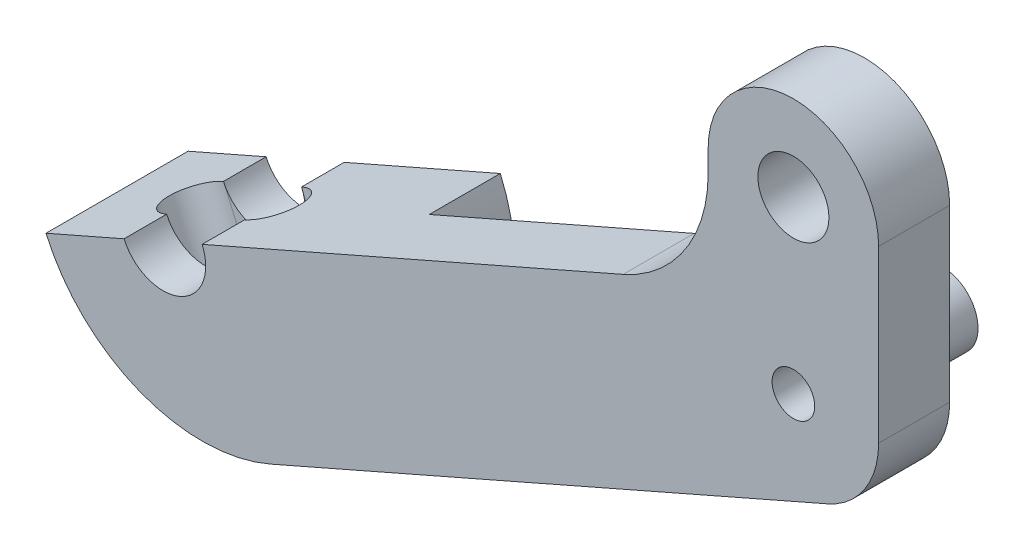
from build123d import *

# Parameters (mm, degrees)
ESBO_O7_R                = 2.5
RESSALTO_EXTRUS_O1_DEPTH = 5
ESBO_O8_R                = 2.5
RESSALTO_EXTRUS_O2_DEPTH = 5.5
ESBO_O9_R                = 1.5
CORTE_EXTRUS_O4_DEPTH    = 25
RESSALTO_EXTRUS_O3_START = 5
RESSALTO_EXTRUS_O3_DEPTH = 5
CORTE_EXTRUS_O5_DEPTH    = 16
SKETCH1_R                = 3.5
SKETCH1_R_2              = 2.5
BOSS_EXTRUDE1_DEPTH      = 0.5


with BuildPart() as part:
    # Esboço7 → Ressalto-extrusão1 (new body)
    with BuildSketch(Plane.XY):
        with BuildLine():
            Line((6, 0), (6, -12))
            ThreePointArc((6, -12), (5.022409129, -15.282591437), (2.40819782, -17.495505733))
            Line((2.40819782, -17.495505733), (-36.810520187, -34.681627592))
            ThreePointArc((-36.810520187, -34.681627592), (-45.993028549, -34.868140884), (-52.617927293, -28.507011766))
            Line((-52.617927293, -28.507011766), (-47.12242156, -26.098813946))
            ThreePointArc((-47.12242156, -26.098813946), (-43.170569784, -27.642467903), (-41.626915827, -23.690616126))
            Line((-41.626915827, -23.690616126), (-11.986336967, -10.701751978))
            ThreePointArc((-11.986336967, -10.701751978), (-7.629318118, -7.013561484), (-6, -1.542575756))
            Line((-6, -1.542575756), (-6, 0))
            ThreePointArc((-6, 0), (0, 6), (6, 0))
        make_face()
        Circle(ESBO_O7_R, mode=Mode.SUBTRACT)
    extrude(amount=RESSALTO_EXTRUS_O1_DEPTH)

    # Esboço8 → Ressalto-extrusão2 (add)
    with BuildSketch(Plane(origin=(0, 0, 0), x_dir=(-1, 0, 0), z_dir=(0, 0, -1))):
        with Locations(Location((0, -12, 0), (0, 0, 180))):
            Circle(ESBO_O8_R)
    extrude(amount=RESSALTO_EXTRUS_O2_DEPTH)

    # Esboço9 → Corte-extrusão4 (cut)
    with BuildSketch(Plane(origin=(0, 0, -5.5), x_dir=(-1, 0, 0), z_dir=(0, 0, -1))):
        with Locations((0, -12)):
            Circle(ESBO_O9_R)
    extrude(amount=-CORTE_EXTRUS_O4_DEPTH, mode=Mode.SUBTRACT)

    # Esboço10 → Ressalto-extrusão3 (add)
    with BuildSketch(Plane(origin=(0, 0, 0), x_dir=(-1, 0, 0), z_dir=(0, 0, -1)).offset(RESSALTO_EXTRUS_O3_START)):
        with BuildLine():
            Line((41.626915827, -23.690616126), (30.635904361, -18.874220487))
            ThreePointArc((30.635904361, -18.874220487), (36.810520187, -34.681627592), (52.617927293, -28.507011766))
            Line((52.617927293, -28.507011766), (47.12242156, -26.098813946))
            ThreePointArc((47.12242156, -26.098813946), (43.170569784, -27.642467903), (41.626915827, -23.690616126))
        make_face()
    extrude(amount=-RESSALTO_EXTRUS_O3_DEPTH)

    # Esboço11 → Corte-extrusão5 (cut)
    with BuildSketch(Plane(origin=(6.819619462, -15.56236682, 0), x_dir=(0.9159176221486781, 0.40136630331595047, 0), z_dir=(0.40136630331595047, -0.9159176221486781, 0))):
        with BuildLine():
            Line((-47.63544078, -2), (-53.63544078, -2))
            ThreePointArc((-53.63544078, -2), (-55.63544078, 0), (-53.63544078, 2))
            Line((-53.63544078, 2), (-47.63544078, 2))
            ThreePointArc((-47.63544078, 2), (-45.63544078, 0), (-47.63544078, -2))
        make_face()
    extrude(amount=-CORTE_EXTRUS_O5_DEPTH, mode=Mode.SUBTRACT)

    # Sketch1 → Boss-Extrude1 (add)
    with BuildSketch(Plane(origin=(0, 0, 0), x_dir=(-1, 0, 0), z_dir=(0, 0, -1))):
        with Locations(Location((0, -12, 0), (0, 0, 180))):
            Circle(SKETCH1_R)
        with Locations((0, -12)):
            Circle(SKETCH1_R_2, mode=Mode.SUBTRACT)
    extrude(amount=BOSS_EXTRUDE1_DEPTH)


solid = part.part
